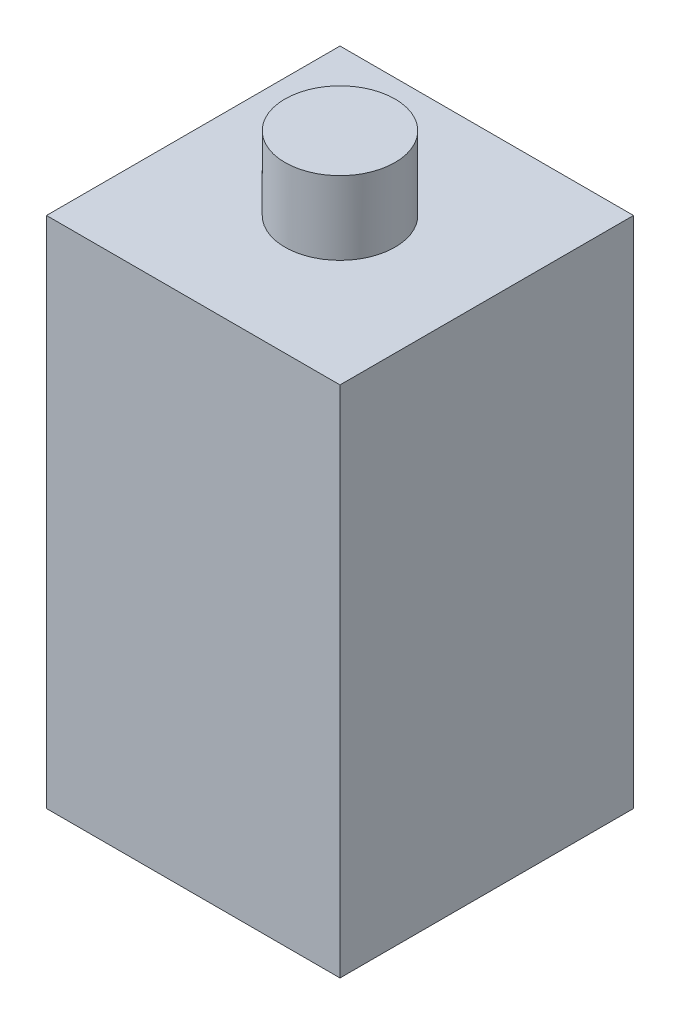
from build123d import *

# Parameters (mm, degrees)
SKETCH2_R           = 3.75
BOSS_EXTRUDE1_DEPTH = 5
SKETCH1_W           = 20
SKETCH1_H           = 20
BOSS_EXTRUDE2_DEPTH = 35


with BuildPart() as part:
    # Sketch2 → Boss-Extrude1 (new body)
    with BuildSketch(Plane(origin=(0, 0, 0), x_dir=(1, 0, 0), z_dir=(0, 1, 0))):
        with Locations(Location((0, 0, 0), (0, 0, 270))):
            Circle(SKETCH2_R)
    extrude(amount=BOSS_EXTRUDE1_DEPTH)

    # Sketch1 → Boss-Extrude2 (add)
    with BuildSketch(Plane(origin=(0, 0, 0), x_dir=(1, 0, 0), z_dir=(0, 1, 0))):
        Rectangle(SKETCH1_W, SKETCH1_H)
    extrude(amount=-BOSS_EXTRUDE2_DEPTH)


solid = part.part
